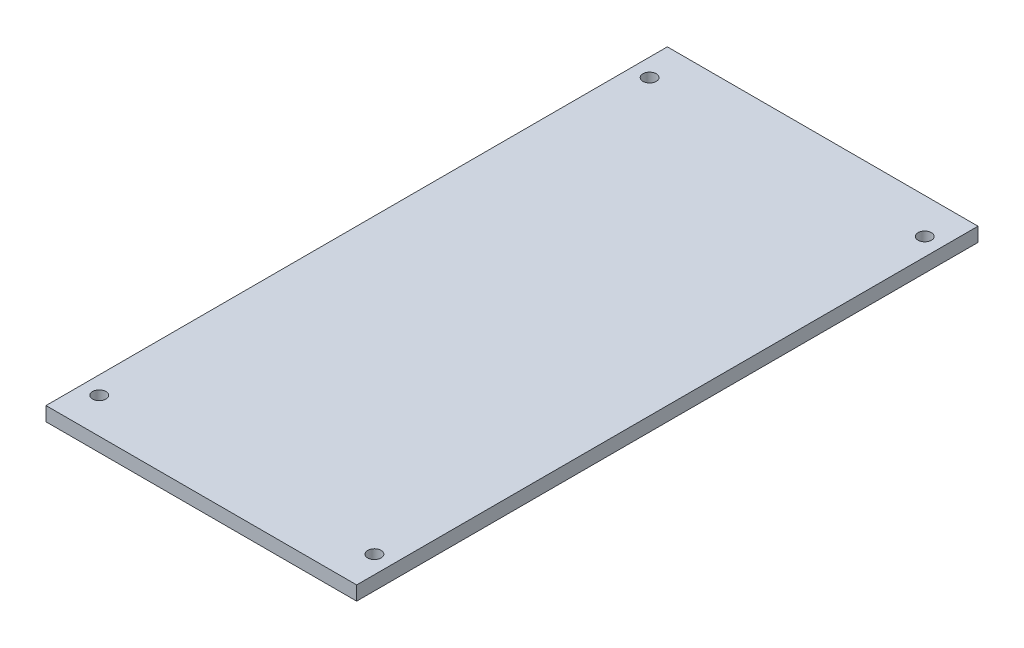
from build123d import *

# Parameters (mm, degrees)
SKETCH2_W           = 70
SKETCH2_H           = 140
SKETCH2_R           = 1.5
BOSS_EXTRUDE1_DEPTH = 3.175


with BuildPart() as part:
    # Sketch2 → Boss-Extrude1 (new body)
    with BuildSketch(Plane(origin=(0, 0, 0), x_dir=(1, 0, 0), z_dir=(0, 1, 0))):
        Rectangle(SKETCH2_W, SKETCH2_H)
        with Locations(Location((31, -62, 0), (0, 0, 270))):
            Circle(SKETCH2_R, mode=Mode.SUBTRACT)
        with Locations(Location((31, 62, 0), (0, 0, 90))):
            Circle(SKETCH2_R, mode=Mode.SUBTRACT)
        with Locations(Location((-31, 62, 0), (0, 0, 270))):
            Circle(SKETCH2_R, mode=Mode.SUBTRACT)
        with Locations(Location((-31, -62, 0), (0, 0, 90))):
            Circle(SKETCH2_R, mode=Mode.SUBTRACT)
    extrude(amount=BOSS_EXTRUDE1_DEPTH)


solid = part.part
